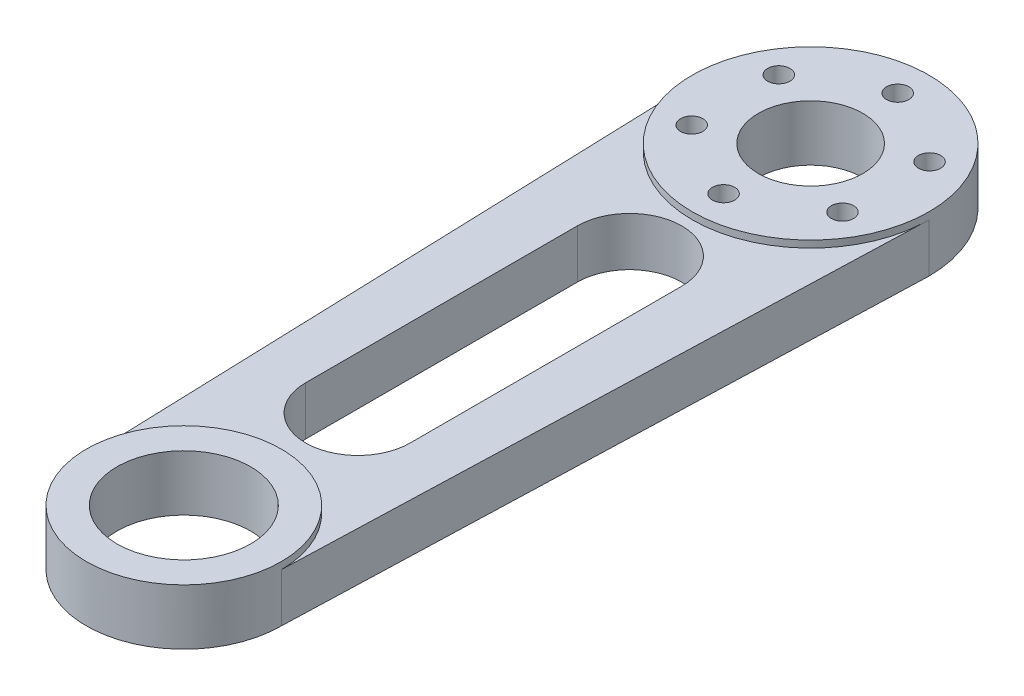
from build123d import *

# Parameters (mm, degrees)
SKETCH_2_R          = 14
SKETCH_2_R_2        = 9.6
SKETCH_2_R_3        = 1.6
SKETCH_2_R_4        = 7.5
EXTRUDE_1_DEPTH     = 7
CUT_EXTRUDE_1_DEPTH = 8
SKETCH_5_R          = 14
SKETCH_5_R_2        = 9.6
EXTRUDE_3_DEPTH     = 1
SKETCH_6_R          = 17
SKETCH_6_R_2        = 7.5
SKETCH_6_R_3        = 1.6
EXTRUDE_4_DEPTH     = 1


with BuildPart() as part:
    # 草图2 → 凸台-拉伸1 (new body)
    # profile 1 of 3: a face of its own
    with BuildSketch(Plane(origin=(0, 0, 0), x_dir=(1, 0, 0), z_dir=(0, 1, 0))):
        with BuildLine():
            Line((-16.962264151, -1.132075472), (-14, -90))
            ThreePointArc((-14, -90), (0, -76), (14, -90))
            Line((14, -90), (16.962264151, -1.132075472))
            ThreePointArc((16.962264151, -1.132075472), (0, -17), (-16.962264151, -1.132075472))
        make_face()
    # profile 2 of 3: a face of its own
    with BuildSketch(Plane(origin=(0, 0, 0), x_dir=(1, 0, 0), z_dir=(0, 1, 0))):
        with Locations((0, -90)):
            Circle(SKETCH_2_R)
        with Locations(Location((0, -90, 0), (0, 0, 270))):
            Circle(SKETCH_2_R_2, mode=Mode.SUBTRACT)
    # profile 3 of 3: a face of its own
    with BuildSketch(Plane(origin=(0, 0, 0), x_dir=(1, 0, 0), z_dir=(0, 1, 0))):
        with BuildLine():
            Line((-17, 0), (-16.962264151, -1.132075472))
            ThreePointArc((-16.962264151, -1.132075472), (0, -17), (16.962264151, -1.132075472))
            Line((16.962264151, -1.132075472), (17, 0))
            ThreePointArc((17, 0), (0, 17), (-17, 0))
        make_face()
        with Locations(Location((-10.825317547, -6.25, 0), (0, 0, 270))):
            Circle(SKETCH_2_R_3, mode=Mode.SUBTRACT)
        with Locations(Location((-10.825317547, 6.25, 0), (0, 0, 270))):
            Circle(SKETCH_2_R_3, mode=Mode.SUBTRACT)
        with Locations(Location((0, -12.5, 0), (0, 0, 270))):
            Circle(SKETCH_2_R_3, mode=Mode.SUBTRACT)
        with Locations(Location((0, 0, 0), (0, 0, 270))):
            Circle(SKETCH_2_R_4, mode=Mode.SUBTRACT)
        with Locations(Location((0, 12.5, 0), (0, 0, 270))):
            Circle(SKETCH_2_R_3, mode=Mode.SUBTRACT)
        with Locations(Location((10.825317547, -6.25, 0), (0, 0, 270))):
            Circle(SKETCH_2_R_3, mode=Mode.SUBTRACT)
        with Locations(Location((10.825317547, 6.25, 0), (0, 0, 270))):
            Circle(SKETCH_2_R_3, mode=Mode.SUBTRACT)
    extrude(amount=EXTRUDE_1_DEPTH)

    # 草图4 → 切除-拉伸1 (cut)
    with BuildSketch(Plane(origin=(0, 7, 0), x_dir=(1, 0, 0), z_dir=(0, 1, 0))):
        with BuildLine():
            Line((7.5, -26), (7.5, -65))
            ThreePointArc((7.5, -65), (0, -72.5), (-7.5, -65))
            Line((-7.5, -65), (-7.5, -26))
            ThreePointArc((-7.5, -26), (0, -18.5), (7.5, -26))
        make_face()
    extrude(amount=-CUT_EXTRUDE_1_DEPTH, mode=Mode.SUBTRACT)

    # 草图5 → 凸台-拉伸3 (add)
    with BuildSketch(Plane(origin=(0, 7, 0), x_dir=(1, 0, 0), z_dir=(0, 1, 0))):
        with Locations((0, -90)):
            Circle(SKETCH_5_R)
        with Locations(Location((0, -90, 0), (0, 0, 270))):
            Circle(SKETCH_5_R_2, mode=Mode.SUBTRACT)
    extrude(amount=EXTRUDE_3_DEPTH)

    # 草图6 → 凸台-拉伸4 (add)
    with BuildSketch(Plane(origin=(0, 7, 0), x_dir=(1, 0, 0), z_dir=(0, 1, 0))):
        Circle(SKETCH_6_R)
        with Locations(Location((0, 0, 0), (0, 0, 270))):
            Circle(SKETCH_6_R_2, mode=Mode.SUBTRACT)
        with Locations(Location((0, 12.5, 0), (0, 0, 270))):
            Circle(SKETCH_6_R_3, mode=Mode.SUBTRACT)
        with Locations(Location((10.825317547, 6.25, 0), (0, 0, 270))):
            Circle(SKETCH_6_R_3, mode=Mode.SUBTRACT)
        with Locations(Location((10.825317547, -6.25, 0), (0, 0, 270))):
            Circle(SKETCH_6_R_3, mode=Mode.SUBTRACT)
        with Locations(Location((0, -12.5, 0), (0, 0, 270))):
            Circle(SKETCH_6_R_3, mode=Mode.SUBTRACT)
        with Locations(Location((-10.825317547, -6.25, 0), (0, 0, 270))):
            Circle(SKETCH_6_R_3, mode=Mode.SUBTRACT)
        with Locations(Location((-10.825317547, 6.25, 0), (0, 0, 270))):
            Circle(SKETCH_6_R_3, mode=Mode.SUBTRACT)
    extrude(amount=EXTRUDE_4_DEPTH)


solid = part.part
